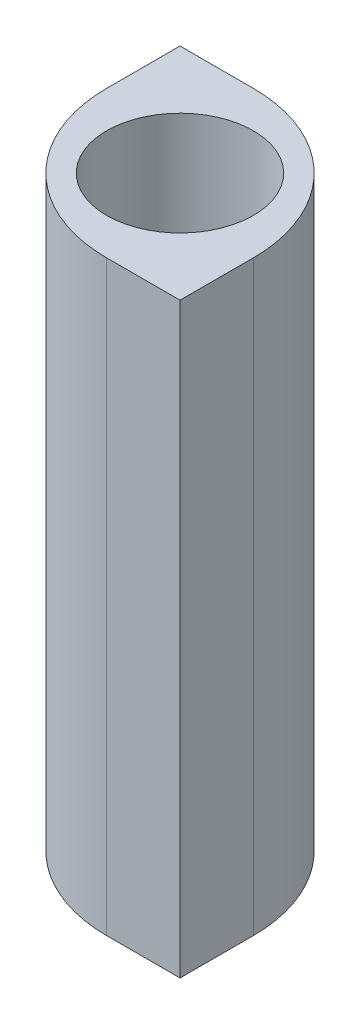
from build123d import *

# Parameters (mm, degrees)
SKETCH_1_R            = 6
EXTRUDE_1_DEPTH       = 40
SKETCH_2_R            = 5
CUT_EXTRUDE_2_DEPTH   = 30
SKETCH_3_R            = 2.5
CUT_EXTRUDE_4_DEPTH   = 10
SKETCH_5_R            = 16
SKETCH_5_R_2          = 6
EXTRUDE_1_2_DEPTH     = 40
SKETCH_6_W            = 32
SKETCH_6_H            = 32
SKETCH_6_W_2          = 12
SKETCH_6_H_2          = 12
EXTRUDE_2_DEPTH       = 40
SKETCH_7_W            = 35
SKETCH_7_H            = 35
SKETCH_7_W_2          = 15
SKETCH_7_H_2          = 15
CUT_EXTRUDE_2_2_DEPTH = 46.956501172
FILLET_1_R            = 10


with BuildPart() as part:
    # 草圖1 → Extrude 1 (new body)
    with BuildSketch(Plane(origin=(0, 0, 0), x_dir=(1, 0, 0), z_dir=(0, 1, 0))):
        with Locations(Location((0, 0, 0), (0, 0, 270))):
            Circle(SKETCH_1_R)
    extrude(amount=EXTRUDE_1_DEPTH)

    # 草圖2 → Cut-Extrude 2 (cut)
    with BuildSketch(Plane(origin=(0, 40, 0), x_dir=(1, 0, 0), z_dir=(0, 1, 0))):
        with Locations(Location((0, 0, 0), (0, 0, 270))):
            Circle(SKETCH_2_R)
    extrude(amount=-CUT_EXTRUDE_2_DEPTH, mode=Mode.SUBTRACT)

    # 草圖3 → 除料-伸長4 (cut)
    with BuildSketch(Plane.XZ):
        with Locations(Location((0, 0, 0), (0, 0, 270))):
            Circle(SKETCH_3_R)
    extrude(amount=-CUT_EXTRUDE_4_DEPTH, mode=Mode.SUBTRACT)

    # 草圖5 → Extrude 1 2 (add)
    with BuildSketch(Plane(origin=(0, 0, 0), x_dir=(1, 0, 0), z_dir=(0, 1, 0))):
        Circle(SKETCH_5_R)
        Circle(SKETCH_5_R_2, mode=Mode.SUBTRACT)
    extrude(amount=EXTRUDE_1_2_DEPTH)

    # 草圖6 → 伸長-薄件2 (add)
    with BuildSketch(Plane(origin=(0, 40, 0), x_dir=(1, 0, 0), z_dir=(0, 1, 0))):
        Rectangle(SKETCH_6_W, SKETCH_6_H)
        Rectangle(SKETCH_6_W_2, SKETCH_6_H_2, mode=Mode.SUBTRACT)
    extrude(amount=-EXTRUDE_2_DEPTH)

    # 草圖7 → Cut-Extrude 2 2 (cut, through all)
    with BuildSketch(Plane(origin=(0, 40, 0), x_dir=(1, 0, 0), z_dir=(0, 1, 0))):
        Rectangle(SKETCH_7_W, SKETCH_7_H)
        Rectangle(SKETCH_7_W_2, SKETCH_7_H_2, mode=Mode.SUBTRACT)
    extrude(amount=-CUT_EXTRUDE_2_2_DEPTH, mode=Mode.SUBTRACT)

    # 圓角1
    fillet_1_edges = [part.edges().sort_by_distance(p)[0] for p in [
        (-7.5, 20, 7.5),
        (7.5, 20, -7.5),
    ]]
    fillet(fillet_1_edges, radius=FILLET_1_R)


solid = part.part
